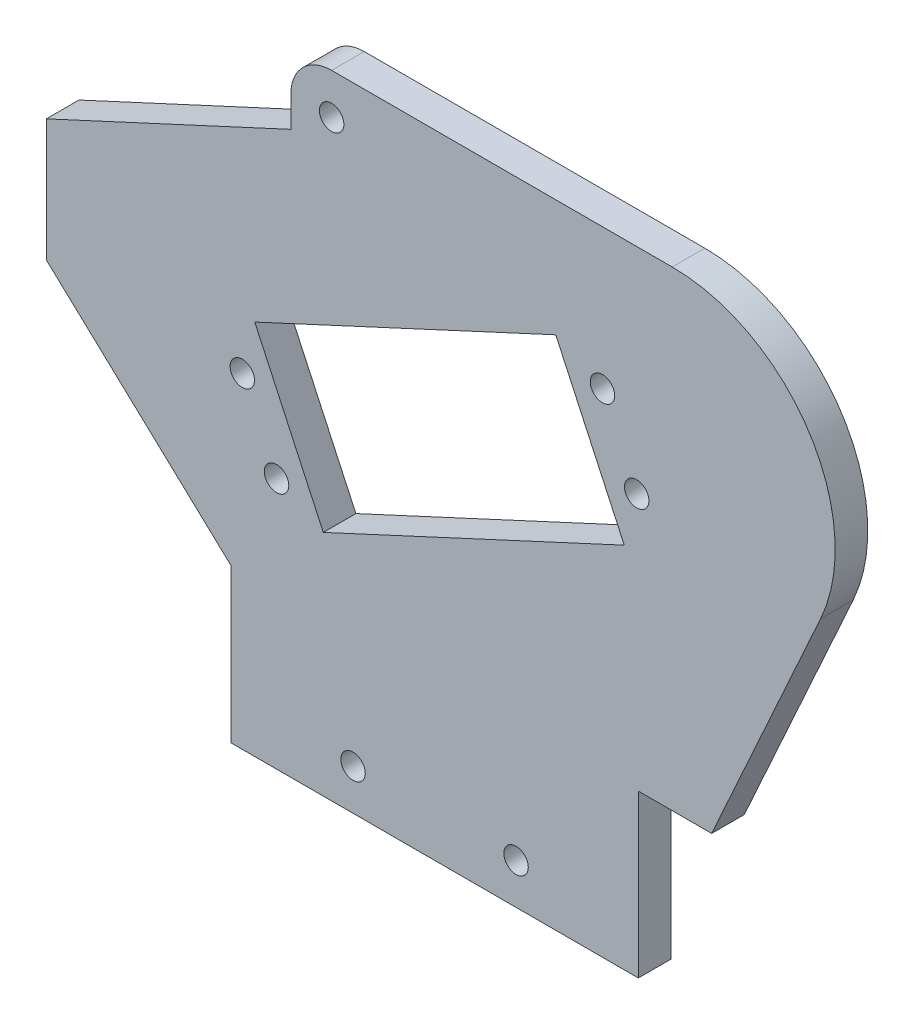
from build123d import *

# Parameters (mm, degrees)
SCHIZZO1_R                   = 2.5
SCHIZZO1_R_2                 = 1.5
ESTRUSIONE_ESTRUSIONE1_DEPTH = 4
TAGLIO_ESTRUSIONE1_DEPTH     = 77.399732917
SCHIZZO3_R                   = 1.5
TAGLIO_ESTRUSIONE2_DEPTH     = 77.399732917
CROQUIS1_W                   = 9
CROQUIS1_H                   = 19.861523984
CORTAR_EXTRUIR1_DEPTH        = 10


with BuildPart() as part:
    # Schizzo1 → Estrusione-Estrusione1 (new body)
    with BuildSketch(Plane.XY):
        with BuildLine():
            Line((15, -50), (-35, -50))
            Line((-35, -50), (-35, -31.140095692))
            Line((-35, -31.140095692), (-57.627416998, -10.021990785))
            Line((-57.627416998, -10.021990785), (-57.627416998, 4.978009215))
            Line((-57.627416998, 4.978009215), (-27.627416998, 18.859904308))
            Line((-27.627416998, 18.859904308), (-27.627416998, 22.627416998))
            ThreePointArc((-27.627416998, 22.627416998), (-26.162950904, 26.162950904), (-22.627416998, 27.627416998))
            Line((-22.627416998, 27.627416998), (19.155603231, 27.627416998))
            ThreePointArc((19.155603231, 27.627416998), (35.964766047, 18.464946487), (37.372583002, -0.627378458))
            Line((37.372583002, -0.627378458), (15, -50))
        make_face()
        Circle(SCHIZZO1_R, mode=Mode.SUBTRACT)
        with Locations((-20, -45)):
            Circle(SCHIZZO1_R_2, mode=Mode.SUBTRACT)
        with Locations((0, -45)):
            Circle(SCHIZZO1_R_2, mode=Mode.SUBTRACT)
        with Locations((-22.627416998, 22.627416998)):
            Circle(SCHIZZO1_R_2, mode=Mode.SUBTRACT)
    extrude(amount=ESTRUSIONE_ESTRUSIONE1_DEPTH)

    # Schizzo2 → Taglio-Estrusione1 (cut, through all)
    with BuildSketch(Plane.XY.offset(4)):
        with BuildLine():
            Line((-27.856099407, -12.90456221), (-2.268412004, -1.050860115))
            ThreePointArc((-2.268412004, -1.050860115), (-1.050860115, 2.268412004), (2.268412004, 1.050860115))
            Line((2.268412004, 1.050860115), (9.073648015, 4.203440459))
            Line((9.073648015, 4.203440459), (4.870207556, 13.277088475))
            Line((4.870207556, 13.277088475), (-32.059539866, -3.830914194))
            Line((-32.059539866, -3.830914194), (-27.856099407, -12.90456221))
        make_face()
        with BuildLine():
            ThreePointArc((2.5, 0), (0.538038098, -2.441416598), (-2.268412004, -1.050860115))
            Line((-2.268412004, -1.050860115), (-27.856099407, -12.90456221))
            Line((-27.856099407, -12.90456221), (-23.652658948, -21.978210225))
            Line((-23.652658948, -21.978210225), (13.277088475, -4.870207556))
            Line((13.277088475, -4.870207556), (9.073648015, 4.203440459))
            Line((9.073648015, 4.203440459), (2.268412004, 1.050860115))
            ThreePointArc((2.268412004, 1.050860115), (2.441416598, 0.538038098), (2.5, 0))
        make_face()
    extrude(amount=-TAGLIO_ESTRUSIONE1_DEPTH, mode=Mode.SUBTRACT)

    # Schizzo3 → Taglio-Estrusione2 (cut, through all)
    with BuildSketch(Plane.XY.offset(4)):
        with Locations((10.601386992, 10.421640651)):
            Circle(SCHIZZO3_R)
        with Locations((14.804827451, 1.347992635)):
            Circle(SCHIZZO3_R)
        with Locations((-29.383838384, -19.122762401)):
            Circle(SCHIZZO3_R)
        with Locations((-33.587278843, -10.049114386)):
            Circle(SCHIZZO3_R)
    extrude(amount=-TAGLIO_ESTRUSIONE2_DEPTH, mode=Mode.SUBTRACT)

    # Croquis1 → Cortar-Extruir1 (cut)
    with BuildSketch(Plane(origin=(0, 0, 0), x_dir=(-1, 0, 0), z_dir=(0, 0, -1))):
        with Locations((-19.5, -40.069238008)):
            Rectangle(CROQUIS1_W, CROQUIS1_H)
    extrude(amount=-CORTAR_EXTRUIR1_DEPTH, mode=Mode.SUBTRACT)


solid = part.part
